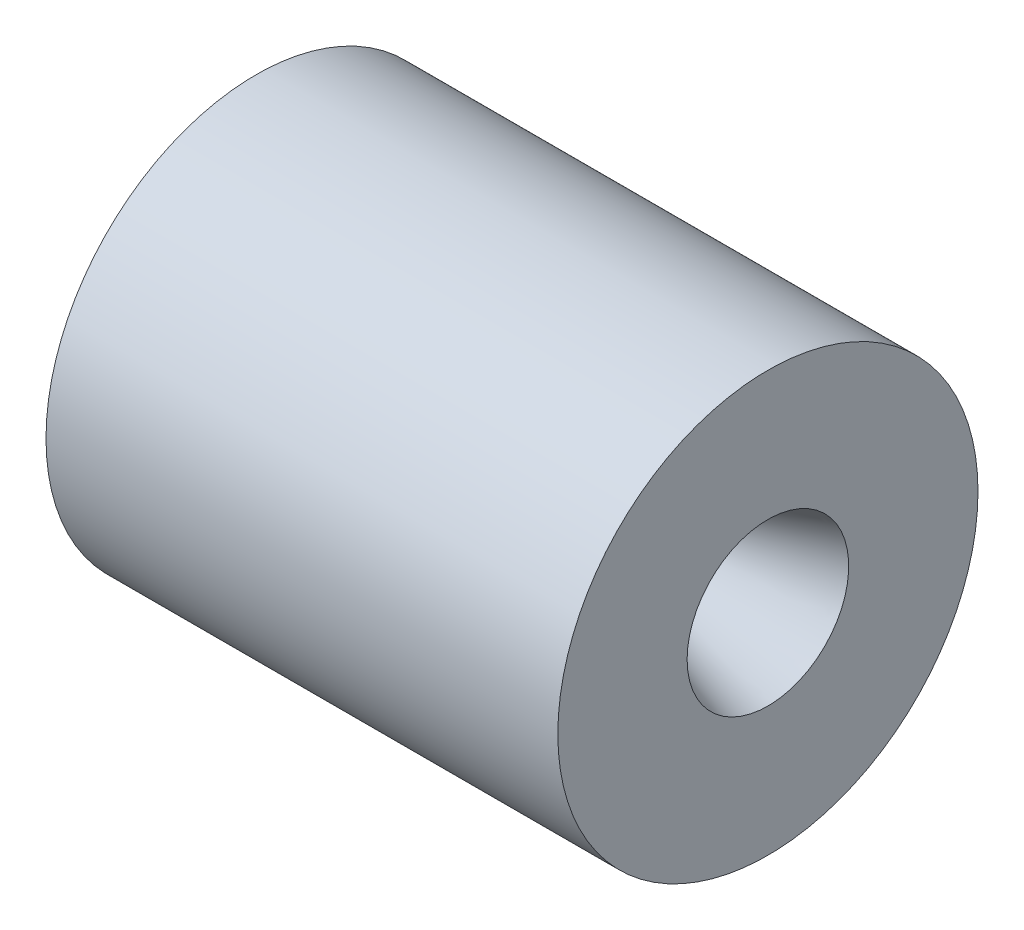
from build123d import *

# Parameters (mm, degrees)
CIRPATTERN1_COUNT = 12


with BuildPart() as part:
    # Model → Revolve1 (revolve)
    with BuildSketch(Plane.XY, mode=Mode.PRIVATE) as revolve1_sk:
        with BuildLine():
            Line((0, 55.140272), (23.150958, 55.140272))
            ThreePointArc((23.150958, 55.140272), (60.421138671, 50.233559208), (95.151418, 35.847806))
            Line((95.151418, 35.847806), (128.566947896, 16.55534082))
            ThreePointArc((128.566947896, 16.55534082), (133.553991718, 14.489639839), (138.905748896, 13.78506782))
            ThreePointArc((138.905748896, 13.78506782), (139.768990342, 13.856305516), (140.608875713, 14.068091181))
            add(Edge.make_bspline(
                [(140.608875713, 14.068091181), (181.460140896, 28.03089782), (185.649173896, 29.31027082)],
                knots=[0, 0, 0, 1, 1, 1], degree=2))
            Line((185.649173896, 29.31027082), (185.649173896, 76.200272))
            Line((185.649173896, 76.200272), (0, 76.200272))
            Line((0, 76.200272), (0, 55.140272))
        make_face()
    revolve(revolve1_sk.sketch.rotate(Axis((0, 0, 0), (1, 0, 0)), 90), axis=Axis((0, 0, 0), (1, 0, 0)))

    # Sketch3 → 13/64 (0.20313) Diameter Hole1 (revolve, cut)
    with BuildSketch(Plane(origin=(0, 0, 69), x_dir=(0, 0, 1), z_dir=(0, 1, 0))):
        Polygon((0, 0), (0, 14.250070783), (2.579751, 12.7), (2.579751, 0), align=None)
    f_13_64_0_20313_diameter_hole1 = revolve(axis=Axis((-6.35, 0, 69), (1, 0, 0)), mode=Mode.SUBTRACT)

    # CirPattern1: 13/64 (0.20313) Diameter Hole1 ×12 about axis
    cirpattern1_axis = Axis((0, 0, 0), (1, 0, 0))
    for i in range(1, CIRPATTERN1_COUNT):
        add(f_13_64_0_20313_diameter_hole1.rotate(cirpattern1_axis, i * 360 / CIRPATTERN1_COUNT), mode=Mode.SUBTRACT)


solid = part.part
